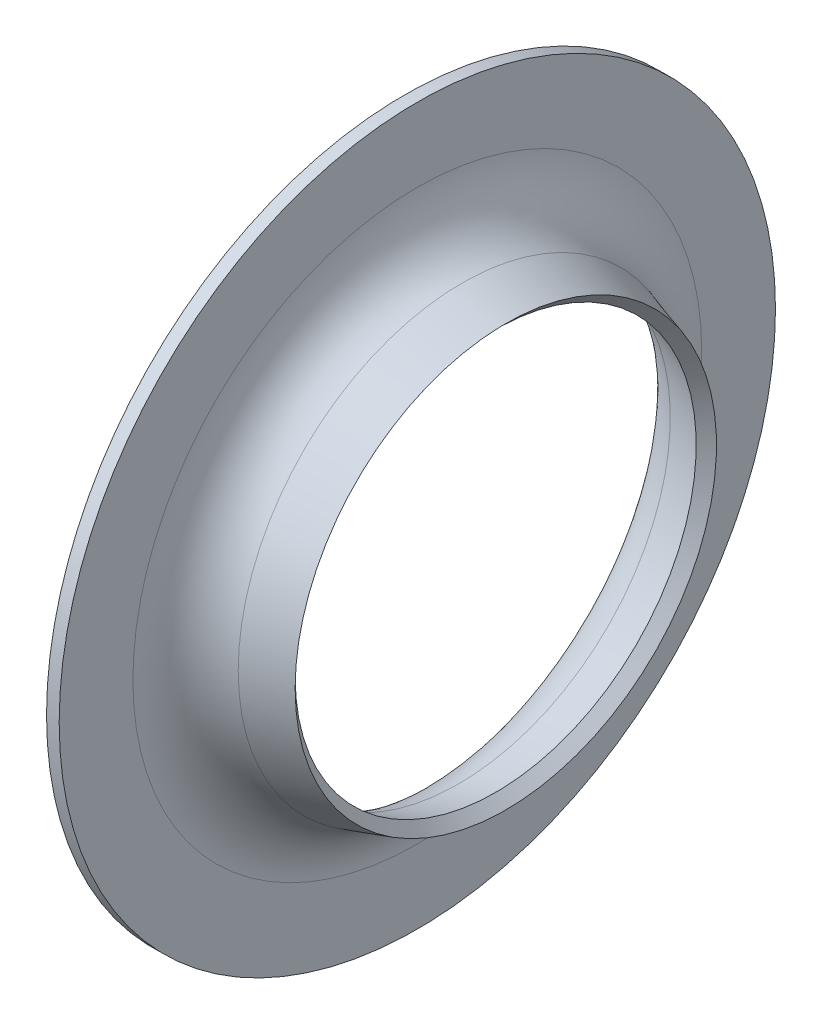
from build123d import *


with BuildPart() as part:
    # 草图1 → 旋转1 (revolve)
    with BuildSketch(Plane.XY, mode=Mode.PRIVATE) as revolve_1_sk:
        with BuildLine():
            Line((-4.2, 17), (-4.2, 13.5))
            ThreePointArc((-4.2, 13.5), (-3.610014447, 11.71343056), (-2.072113091, 10.629561226))
            Line((-2.072113091, 10.629561226), (0, 10))
            Line((0, 10), (-0.480955259, 9.519044741))
            Line((-0.480955259, 9.519044741), (-2.246535709, 10.055473471))
            ThreePointArc((-2.246535709, 10.055473471), (-4.092017337, 11.356116672), (-4.8, 13.5))
            Line((-4.8, 13.5), (-4.8, 17))
            Line((-4.8, 17), (-4.2, 17))
        make_face()
    revolve(revolve_1_sk.sketch.rotate(Axis((-48.745596361, 0, 0), (1, 0, 0)), 90), axis=Axis((-48.745596361, 0, 0), (1, 0, 0)))


solid = part.part
